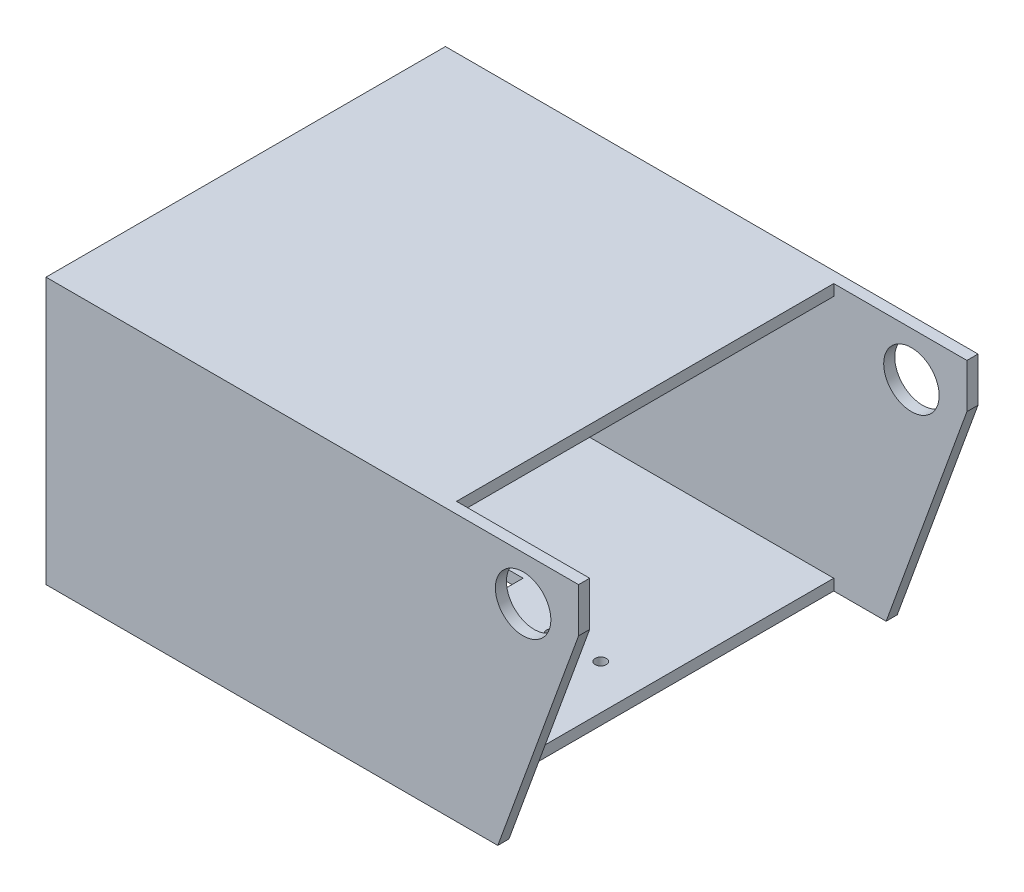
from build123d import *

# Parameters (mm, degrees)
SKETCH1_W               = 152.4
SKETCH1_H               = 114.3
BOSS_EXTRUDE1_DEPTH     = 76.2
CUT_EXTRUDE1_DEPTH      = 142.677746119
CUT_EXTRUDE1_DEPTH_BACK = 142.677746119
SKETCH5_W               = 38.1
SKETCH5_H               = 107.95
CUT_EXTRUDE4_DEPTH      = 142.677746119
CUT_EXTRUDE5_DEPTH      = 169.235334824
CUT_EXTRUDE5_DEPTH_BACK = 169.235334824
SKETCH6_R               = 7.9375
SKETCH8_W               = 107.95
SKETCH8_H               = 69.85
CUT_EXTRUDE6_DEPTH      = 185.027568212
SKETCH9_R               = 1.5875
CUT_EXTRUDE7_DEPTH      = 3.175
SKETCH10_W              = 63.5
SKETCH10_H              = 19.05
CUT_EXTRUDE8_DEPTH      = 5.715


with BuildPart() as part:
    # Sketch1 → Boss-Extrude1 (new body)
    with BuildSketch(Plane(origin=(0, 0, 0), x_dir=(1, 0, 0), z_dir=(0, 1, 0))):
        with Locations((-20.919503106, -12.376583851)):
            Rectangle(SKETCH1_W, SKETCH1_H)
    extrude(amount=BOSS_EXTRUDE1_DEPTH)

    # Sketch3 → Cut-Extrude1 (cut, two sides: drawn at the far end of the back side and taken through both)
    with BuildSketch(Plane.XY.offset(-CUT_EXTRUDE1_DEPTH_BACK)):
        Polygon((55.280496894, 63.5), (32.168387019, 0), (55.280496894, 0), align=None)
    extrude(amount=CUT_EXTRUDE1_DEPTH + CUT_EXTRUDE1_DEPTH_BACK, mode=Mode.SUBTRACT)

    # Sketch5 → Cut-Extrude4 (cut, through all)
    with BuildSketch(Plane(origin=(0, 0, 0), x_dir=(1, 0, 0), z_dir=(0, 1, 0))):
        with Locations((36.230496894, -12.376583851)):
            Rectangle(SKETCH5_W, SKETCH5_H)
    extrude(amount=CUT_EXTRUDE4_DEPTH, mode=Mode.SUBTRACT)

    # Sketch6 → Cut-Extrude5 (cut, two sides: drawn at the far end of the back side and taken through both)
    with BuildSketch(Plane.XY.offset(69.526583851).offset(-CUT_EXTRUDE5_DEPTH_BACK)):
        with Locations((39.405496894, 63.5)):
            Circle(SKETCH6_R)
    extrude(amount=CUT_EXTRUDE5_DEPTH + CUT_EXTRUDE5_DEPTH_BACK, mode=Mode.SUBTRACT)

    # Sketch8 → Cut-Extrude6 (cut, through all)
    with BuildSketch(Plane.ZY.offset(97.119503106)):
        with Locations((12.376583851, 38.1)):
            Rectangle(SKETCH8_W, SKETCH8_H)
    extrude(amount=-CUT_EXTRUDE6_DEPTH, mode=Mode.SUBTRACT)

    # Sketch9 → Cut-Extrude7 (cut)
    with BuildSketch(Plane.XZ):
        with Locations(Location((4.480496894, 12.376583851, 0), (0, 0, 270))):
            Circle(SKETCH9_R)
        with Locations(Location((-9.489503106, 12.376583851, 0), (0, 0, 270))):
            Circle(SKETCH9_R)
    extrude(amount=-CUT_EXTRUDE7_DEPTH, mode=Mode.SUBTRACT)

    # Sketch10 → Cut-Extrude8 (cut)
    with BuildSketch(Plane.XZ):
        with Locations((-59.019503106, 12.376583851)):
            Rectangle(SKETCH10_W, SKETCH10_H)
    extrude(amount=-CUT_EXTRUDE8_DEPTH, mode=Mode.SUBTRACT)


solid = part.part
